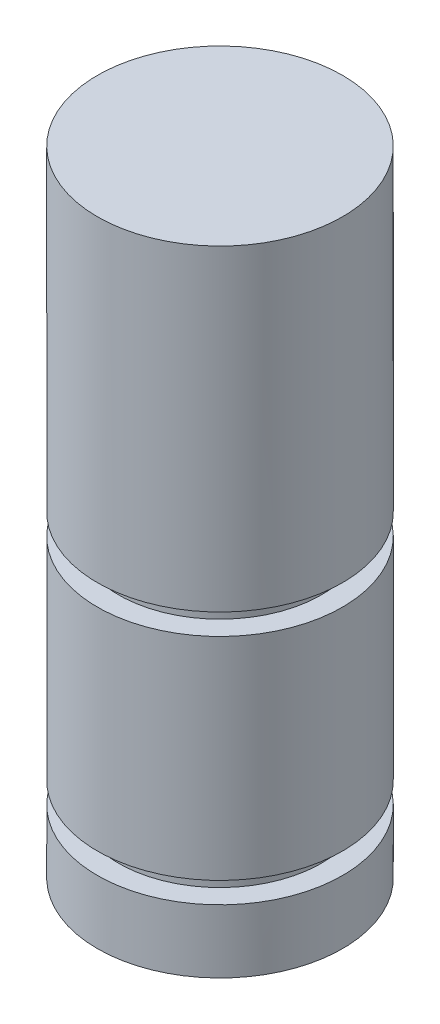
from build123d import *

# Parameters (mm, degrees)
SKETCH1_R           = 5.8
BOSS_EXTRUDE1_DEPTH = 30
SKETCH2_R           = 2.1
CUT_EXTRUDE1_DEPTH  = 10
SKETCH3_R           = 5.8
SKETCH3_R_2         = 4.8
CUT_EXTRUDE2_DEPTH  = 1
CUT_EXTRUDE3_START  = 1
SKETCH4_R           = 5.8
SKETCH4_R_2         = 4.8
CUT_EXTRUDE3_DEPTH  = 1


with BuildPart() as part:
    # Sketch1 → Boss-Extrude1 (new body)
    with BuildSketch(Plane(origin=(0, 0, 0), x_dir=(1, 0, 0), z_dir=(0, 1, 0))):
        with Locations(Location((0, 0, 0), (0, 0, 270))):
            Circle(SKETCH1_R)
    extrude(amount=BOSS_EXTRUDE1_DEPTH)

    # Sketch2 → Cut-Extrude1 (cut)
    with BuildSketch(Plane.XZ):
        with Locations(Location((0, 0, 0), (0, 0, 270))):
            Circle(SKETCH2_R)
    extrude(amount=-CUT_EXTRUDE1_DEPTH, mode=Mode.SUBTRACT)

    # Sketch3 → Cut-Extrude2 (cut)
    with BuildSketch(Plane(origin=(0, 14, 0), x_dir=(-1, 0, 0), z_dir=(0, -1, 0))):
        with Locations(Location((0, 0, 0), (0, 0, 90))):
            Circle(SKETCH3_R)
        with Locations(Location((0, 0, 0), (0, 0, 90))):
            Circle(SKETCH3_R_2, mode=Mode.SUBTRACT)
    extrude(amount=-CUT_EXTRUDE2_DEPTH, mode=Mode.SUBTRACT)

    # Sketch4 → Cut-Extrude3 (cut)
    with BuildSketch(Plane(origin=(0, 4, 0), x_dir=(-1, 0, 0), z_dir=(0, -1, 0)).offset(CUT_EXTRUDE3_START)):
        with Locations(Location((0, 0, 0), (0, 0, 90))):
            Circle(SKETCH4_R)
        with Locations(Location((0, 0, 0), (0, 0, 90))):
            Circle(SKETCH4_R_2, mode=Mode.SUBTRACT)
    extrude(amount=-CUT_EXTRUDE3_DEPTH, mode=Mode.SUBTRACT)


solid = part.part
